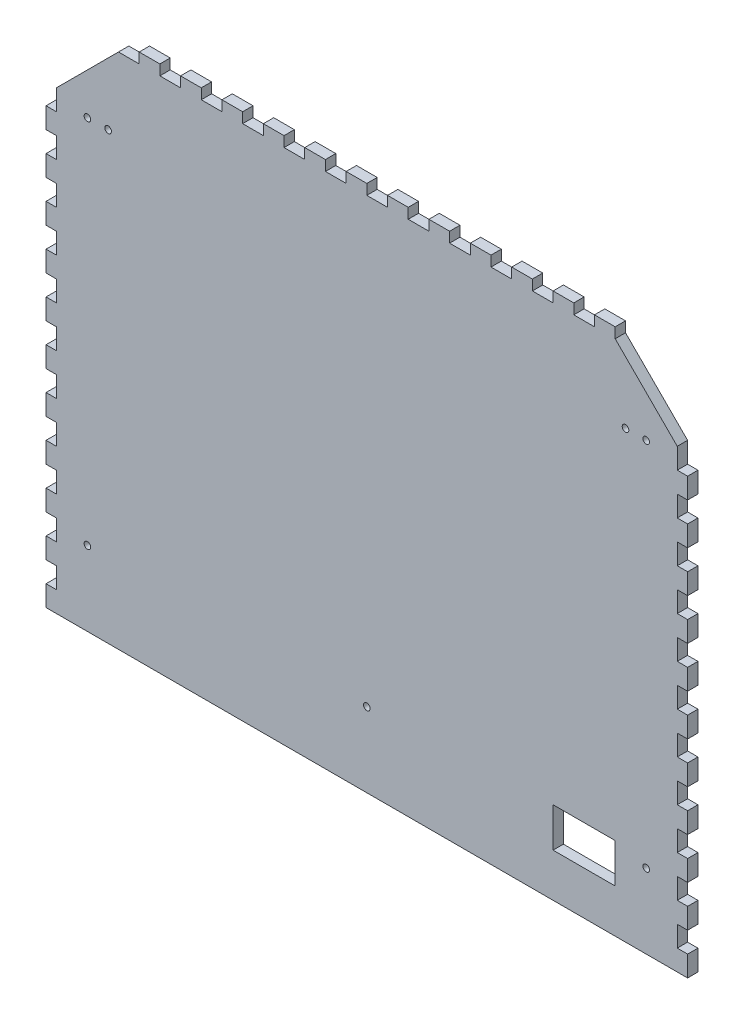
from build123d import *

# Parameters (mm, degrees)
SKIZZE1_R                       = 1.6
SKIZZE1_W                       = 30
SKIZZE1_H                       = 19
AUFSATZ_LINEAR_AUSTRAGEN1_DEPTH = 5


with BuildPart() as part:
    # Skizze1 → Aufsatz-Linear austragen1 (new body)
    with BuildSketch(Plane.XY):
        Polygon((5, 10), (5, 20), (0, 20), (0, 30), (5, 30), (5, 40), (0, 40), (0, 50), (5, 50), (5, 60), (0, 60), (0, 70), (5, 70), (5, 80), (0, 80), (0, 90), (5, 90), (5, 100), (0, 100), (0, 110), (5, 110), (5, 120), (0, 120), (0, 130), (5, 130), (5, 140), (0, 140), (0, 150), (5, 150), (5, 160), (0, 160), (0, 170), (5, 170), (5, 180), (0, 180), (0, 190), (5, 190), (5, 200), (0, 200), (0, 210), (5, 210), (5, 220), (35, 250), (45, 250), (45, 255), (55, 255), (55, 250), (65, 250), (65, 255), (75, 255), (75, 250), (85, 250), (85, 255), (95, 255), (95, 250), (105, 250), (105, 255), (115, 255), (115, 250), (125, 250), (125, 255), (135, 255), (135, 250), (145, 250), (145, 255), (155, 255), (155, 250), (165, 250), (165, 255), (175, 255), (175, 250), (185, 250), (185, 255), (195, 255), (195, 250), (205, 250), (205, 255), (215, 255), (215, 250), (225, 250), (225, 255), (235, 255), (235, 250), (245, 250), (245, 255), (255, 255), (255, 250), (265, 250), (265, 255), (275, 255), (275, 250), (305, 220), (305, 210), (310, 210), (310, 200), (305, 200), (305, 190), (310, 190), (310, 180), (305, 180), (305, 170), (310, 170), (310, 160), (305, 160), (305, 150), (310, 150), (310, 140), (305, 140), (305, 130), (310, 130), (310, 120), (305, 120), (305, 110), (310, 110), (310, 100), (305, 100), (305, 90), (310, 90), (310, 80), (305, 80), (305, 70), (310, 70), (310, 60), (305, 60), (305, 50), (310, 50), (310, 40), (305, 40), (305, 30), (310, 30), (310, 20), (305, 20), (305, 10), (310, 10), (310, 0), (305, 0), (5, 0), (0, 0), (0, 10), align=None)
        with Locations((20, 215)):
            Circle(SKIZZE1_R, mode=Mode.SUBTRACT)
        with Locations((30, 215)):
            Circle(SKIZZE1_R, mode=Mode.SUBTRACT)
        with Locations((290, 215)):
            Circle(SKIZZE1_R, mode=Mode.SUBTRACT)
        with Locations((280, 215)):
            Circle(SKIZZE1_R, mode=Mode.SUBTRACT)
        with Locations((20, 36)):
            Circle(SKIZZE1_R, mode=Mode.SUBTRACT)
        with Locations((155, 36)):
            Circle(SKIZZE1_R, mode=Mode.SUBTRACT)
        with Locations((290, 36)):
            Circle(SKIZZE1_R, mode=Mode.SUBTRACT)
        with Locations((260, 30.5)):
            Rectangle(SKIZZE1_W, SKIZZE1_H, mode=Mode.SUBTRACT)
    extrude(amount=AUFSATZ_LINEAR_AUSTRAGEN1_DEPTH)


solid = part.part
